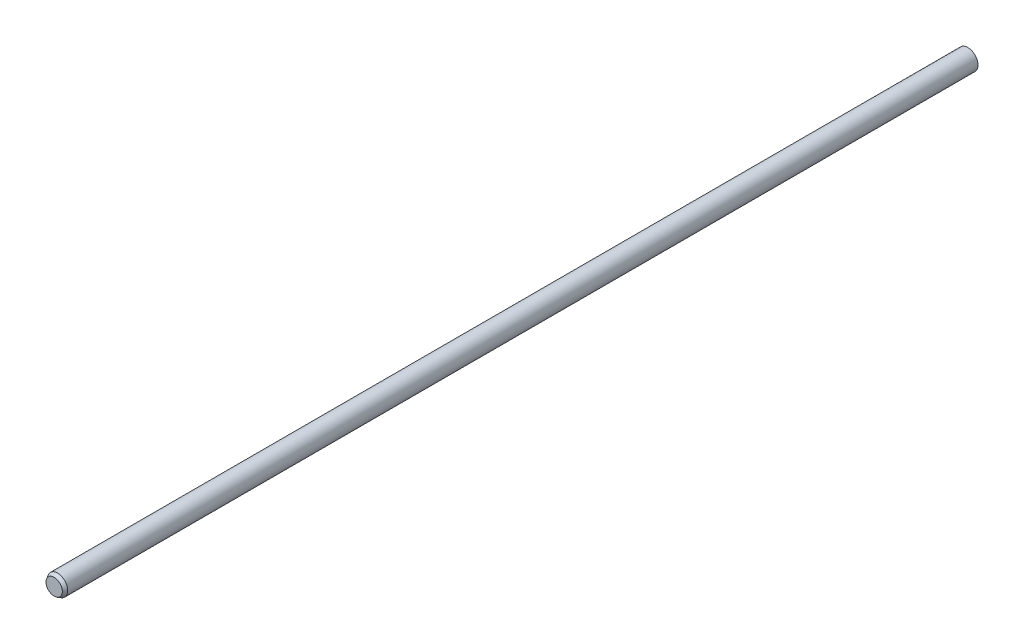
from build123d import *
from OCP.BRepFilletAPI import BRepFilletAPI_MakeChamfer

# Parameters (mm, degrees)
SKETCH1_R           = 3
BOSS_EXTRUDE1_DEPTH = 271
CHAMFER1_SIZE       = 1
CHAMFER1_SIZE2      = 0.577350269


with BuildPart() as part:
    # Sketch1 → Boss-Extrude1 (new body)
    with BuildSketch(Plane.XY):
        Circle(SKETCH1_R)
    extrude(amount=BOSS_EXTRUDE1_DEPTH)

    # Chamfer1: one chamfer whose edges measure the first distance from different faces: ONE call of the kernel's chamfer builder (chamfer() names one face for all edges)
    chamfer1_edges_1 = [part.edges().sort_by_distance(p)[0] for p in [
        (-3, 0, 0),
    ]]
    chamfer1_side_1 = [part.faces().sort_by_distance(p)[0] for p in [
        (0, 0, 0),
    ]]
    chamfer1_edges_2 = [part.edges().sort_by_distance(p)[0] for p in [
        (-3, 0, 271),
    ]]
    chamfer1_side_2 = [part.faces().sort_by_distance(p)[0] for p in [
        (-3, 0, 135.5),
    ]]
    chamfer1 = BRepFilletAPI_MakeChamfer(part.part.solid().wrapped)
    for e in chamfer1_edges_1:
        chamfer1.Add(CHAMFER1_SIZE, CHAMFER1_SIZE2, e.wrapped, chamfer1_side_1[0].wrapped)  # the first distance lies on this face
    for e in chamfer1_edges_2:
        chamfer1.Add(CHAMFER1_SIZE, CHAMFER1_SIZE2, e.wrapped, chamfer1_side_2[0].wrapped)  # the first distance lies on this face
    add(Compound.cast(chamfer1.Shape()), mode=Mode.REPLACE)


solid = part.part
